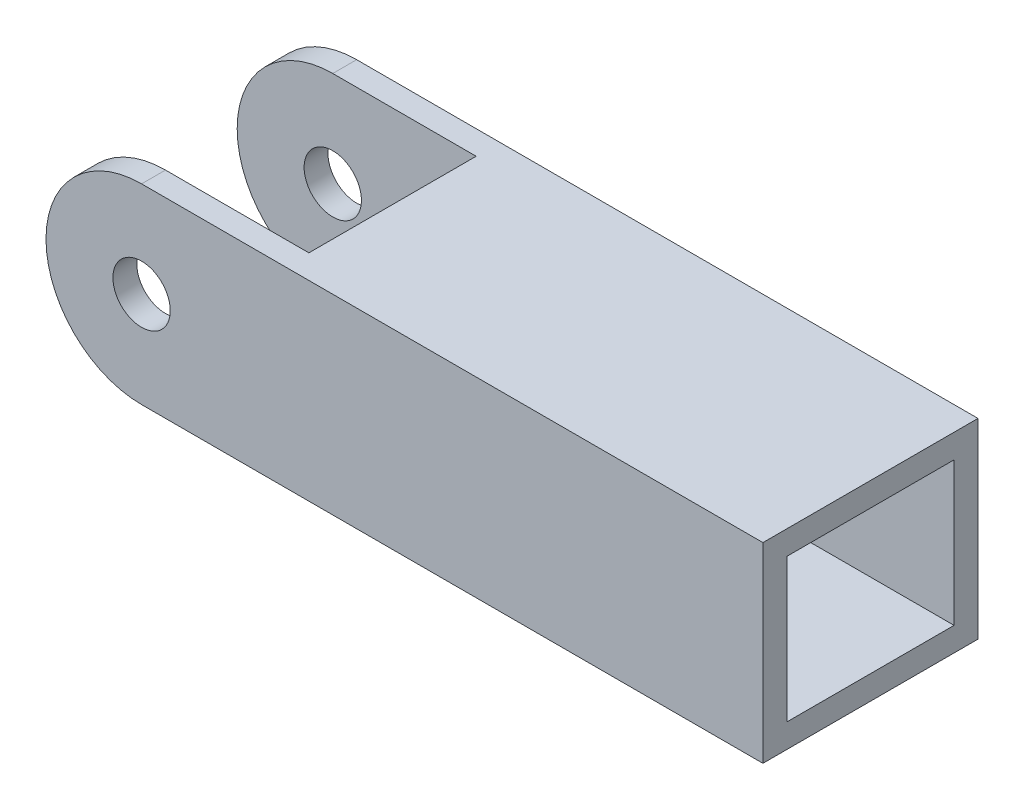
from build123d import *

# Parameters (mm, degrees)
DODANIE_WYCI_GNI_CIE1_DEPTH = 5
SZKIC2_W                    = 100
SZKIC2_H                    = 35
DODANIE_WYCI_GNI_CIE2_DEPTH = 5
SZKIC3_R                    = 6
WYTNIJ_WYCI_GNI_CIE1_DEPTH  = 99.234413522
SZKIC4_W                    = 100
SZKIC4_H                    = 40
DODANIE_WYCI_GNI_CIE3_DEPTH = 5


with BuildPart() as part:
    # Szkic1 → Dodanie-wyciągnięcie1 (new body)
    with BuildSketch(Plane.XY):
        with BuildLine():
            Line((-65, -20), (65, -20))
            Line((65, -20), (65, 20))
            Line((65, 20), (-65, 20))
            ThreePointArc((-65, 20), (-85, 0), (-65, -20))
        make_face()
    extrude(amount=DODANIE_WYCI_GNI_CIE1_DEPTH)


with BuildPart() as body_2:
    # Lustro2: mirrored copy
    add(part.part.mirror(Plane.XY.offset(22.5)))


with BuildPart() as part_1:
    add(part.part)

    add(body_2.part)  # Dodanie-wyciągnięcie2 merges body 2
    # Szkic2 → Dodanie-wyciągnięcie2 (add)
    with BuildSketch(Plane(origin=(0, 20, 0), x_dir=(1, 0, 0), z_dir=(0, 1, 0))):
        with Locations((15, -22.5)):
            Rectangle(SZKIC2_W, SZKIC2_H)
    extrude(amount=-DODANIE_WYCI_GNI_CIE2_DEPTH)

    # Szkic3 → Wytnij-wyciągnięcie1 (cut, through all)
    with BuildSketch(Plane(origin=(0, 0, 0), x_dir=(-1, 0, 0), z_dir=(0, 0, -1))):
        with Locations((65, 0)):
            Circle(SZKIC3_R)
    extrude(amount=-WYTNIJ_WYCI_GNI_CIE1_DEPTH, mode=Mode.SUBTRACT)

    # Szkic4 → Dodanie-wyciągnięcie3 (add)
    with BuildSketch(Plane.XZ.offset(20)):
        with Locations((15, 20)):
            Rectangle(SZKIC4_W, SZKIC4_H)
    extrude(amount=-DODANIE_WYCI_GNI_CIE3_DEPTH)


solid = part_1.part
